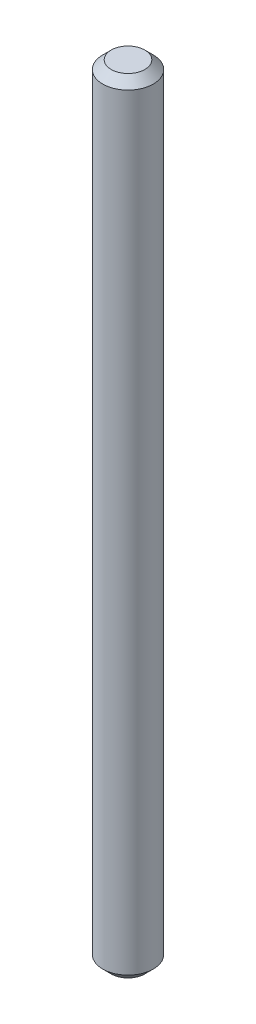
from build123d import *

# Parameters (mm, degrees)
SKETCH1_W     = 3
SKETCH1_H     = 93
CHAMFER1_SIZE = 1


with BuildPart() as part:
    # Sketch1 → Revolve1 (revolve)
    with BuildSketch(Plane.XY, mode=Mode.PRIVATE) as revolve1_sk:
        with Locations((1.5, 46.5)):
            Rectangle(SKETCH1_W, SKETCH1_H)
    revolve(revolve1_sk.sketch.rotate(Axis((0, 0, 0), (0, 1, 0)), 90), axis=Axis((0, 0, 0), (0, 1, 0)))

    # Chamfer1
    chamfer1_edges = [part.edges().sort_by_distance(p)[0] for p in [
        (0, 0, 3),
        (0, 93, 3),
    ]]
    chamfer(chamfer1_edges, length=CHAMFER1_SIZE)


solid = part.part
